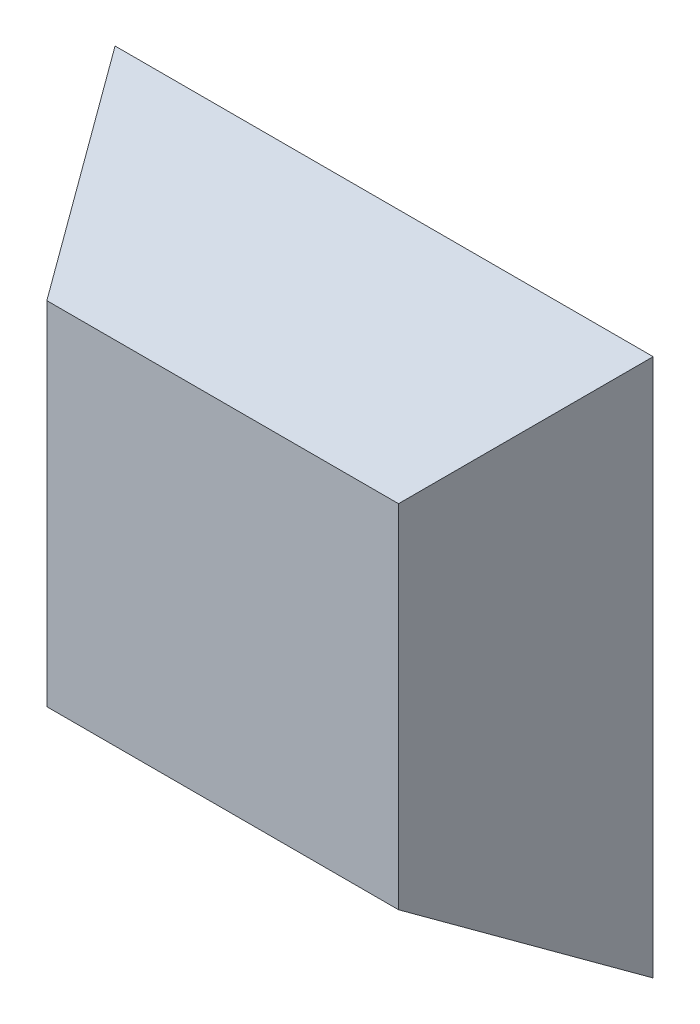
from build123d import *

# Parameters (mm, degrees)
SKETCH1_W           = 400
SKETCH1_H           = 400
BOSS_EXTRUDE1_DEPTH = 120
BOSS_EXTRUDE1_TAPER = 30


with BuildPart() as part:
    # Sketch1 → Boss-Extrude1 (new body)
    with BuildSketch(Plane.XY):
        Rectangle(SKETCH1_W, SKETCH1_H)
    extrude(amount=BOSS_EXTRUDE1_DEPTH, taper=BOSS_EXTRUDE1_TAPER)


solid = part.part
